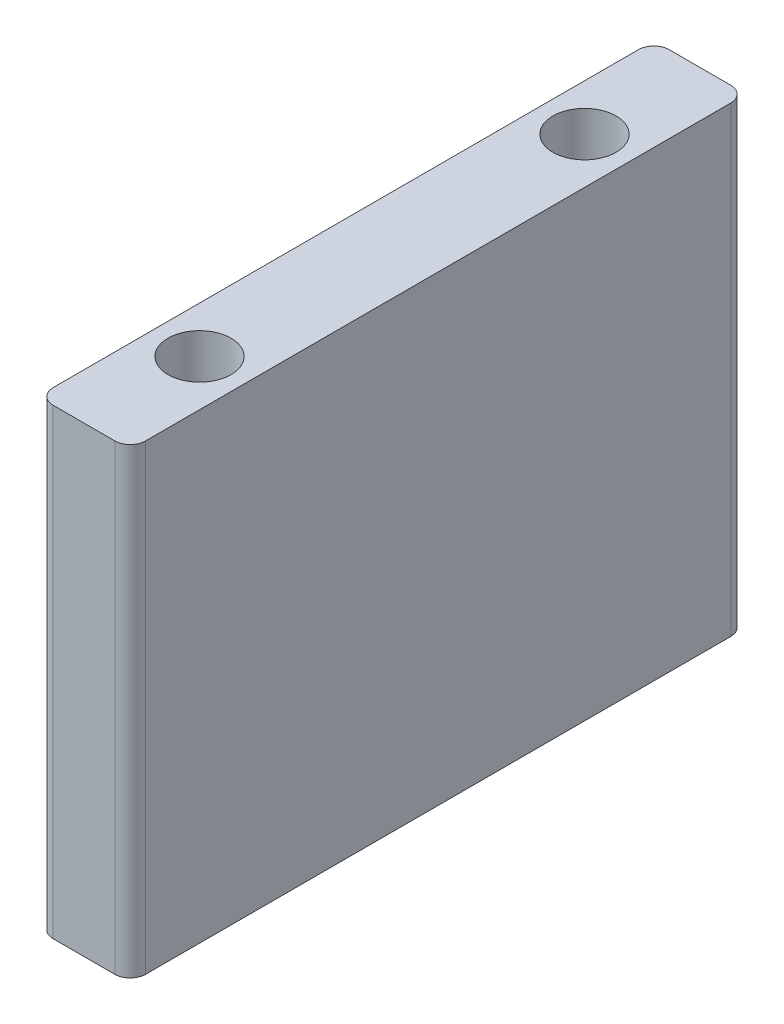
from build123d import *

# Parameters (mm, degrees)
SKETCH_1_R      = 2.05
EXTRUDE_1_DEPTH = 30


with BuildPart() as part:
    # 草图1 → 凸台-拉伸1 (new body)
    with BuildSketch(Plane(origin=(0, 0, 0), x_dir=(1, 0, 0), z_dir=(0, 1, 0))):
        with BuildLine():
            Line((-2, 20), (2, 20))
            ThreePointArc((2, 20), (2.707106781, 19.707106781), (3, 19))
            Line((3, 19), (3, -19))
            ThreePointArc((3, -19), (2.707106781, -19.707106781), (2, -20))
            Line((2, -20), (-2, -20))
            ThreePointArc((-2, -20), (-2.707106781, -19.707106781), (-3, -19))
            Line((-3, -19), (-3, 19))
            ThreePointArc((-3, 19), (-2.707106781, 19.707106781), (-2, 20))
        make_face()
        with Locations(Location((0, 12.5, 0), (0, 0, 270))):
            Circle(SKETCH_1_R, mode=Mode.SUBTRACT)
        with Locations(Location((0, -12.5, 0), (0, 0, 90))):
            Circle(SKETCH_1_R, mode=Mode.SUBTRACT)
    extrude(amount=EXTRUDE_1_DEPTH)


solid = part.part
